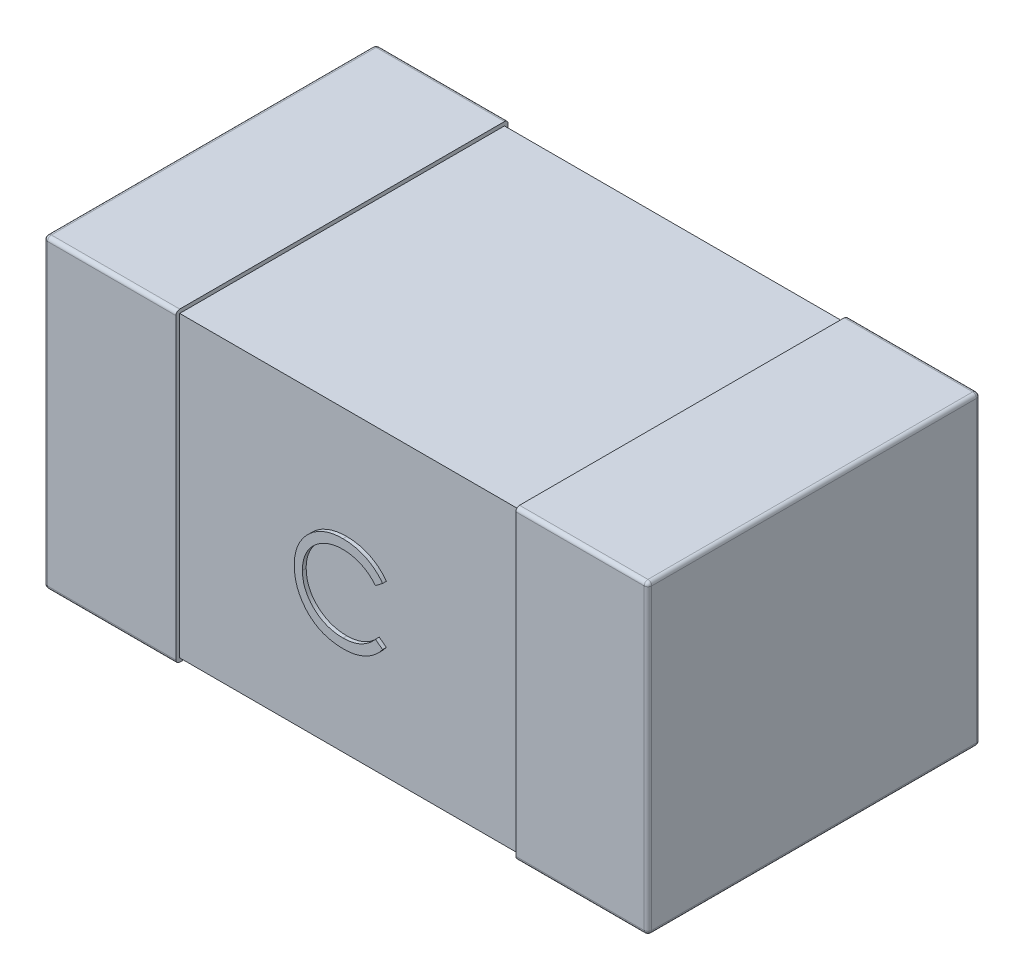
from build123d import *

# Parameters (mm, degrees)
EXTRUDE_1_DEPTH        = 0.87
EXTRUDE_1_DEPTH_BACK   = 0.01
SKETCH_3_W             = 0.35
SKETCH_3_H             = 0.81
EXTRUDE_1_2_DEPTH      = 0.87
EXTRUDE_1_2_DEPTH_BACK = 0.01
SKETCH_5_W             = 0.86
SKETCH_5_H             = 0.79
EXTRUDE_3_DEPTH        = 0.455
FILLET_3_R             = 0.01
EXTRUDE_4_DEPTH        = 0.01


with BuildPart() as part:
    # 草图3 → 凸台-拉伸1 (new, two sides: drawn at the far end of the back side and taken through both)
    with BuildSketch(Plane.XY.offset(-EXTRUDE_1_DEPTH_BACK)):
        with Locations((-0.625, 0)):
            Rectangle(SKETCH_3_W, SKETCH_3_H)
    extrude(amount=EXTRUDE_1_DEPTH + EXTRUDE_1_DEPTH_BACK)



with BuildPart() as body_2:
    # 草图3 → Extrude 1 2 (new, two sides: drawn at the far end of the back side and taken through both)
    with BuildSketch(Plane.XY.offset(-EXTRUDE_1_2_DEPTH_BACK)):
        with Locations((0.625, 0)):
            Rectangle(SKETCH_3_W, SKETCH_3_H)
    extrude(amount=EXTRUDE_1_2_DEPTH + EXTRUDE_1_2_DEPTH_BACK)


with BuildPart() as part_1:
    add(part.part)

    add(body_2.part)  # 凸台-拉伸3 merges body 2
    # 草图5 → 凸台-拉伸3 (add, symmetric)
    with BuildSketch(Plane(origin=(0, 0, 0), x_dir=(0, 0, -1), z_dir=(1, 0, 0))):
        with Locations((-0.43, 0)):
            Rectangle(SKETCH_5_W, SKETCH_5_H)
    extrude(amount=EXTRUDE_3_DEPTH, both=True)

    # 圆角3
    fillet_3_edges = [part_1.edges().sort_by_distance(p)[0] for p in [
        (-0.8, 0, -0.01),
        (-0.625, 0.405, 0.87),
        (-0.625, -0.405, -0.01),
        (-0.8, 0, 0.87),
        (-0.625, -0.405, 0.87),
        (0.8, 0.405, 0.43),
        (0.8, 0, -0.01),
        (0.8, -0.405, 0.43),
        (0.625, -0.405, -0.01),
        (0.625, 0.405, -0.01),
        (0.8, 0, 0.87),
        (0.625, 0.405, 0.87),
        (0.625, -0.405, 0.87),
        (-0.625, 0.405, -0.01),
        (-0.8, -0.405, 0.43),
        (-0.8, 0.405, 0.43),
    ]]
    fillet(fillet_3_edges, radius=FILLET_3_R)

    # 草图6 → 凸台-拉伸4 (add)
    with BuildSketch(Plane.XY.offset(0.86)):
        with BuildLine():
            Line((0.097254857, 0.0543379), (0.078408703, 0.039914823))
            add(Edge.make_bspline(
                [(0.078408703, 0.039914823), (0.077064299, 0.041517061), (0.074393617, 0.044699935), (0.070096986, 0.04916939), (0.065619159, 0.053356722), (0.060961848, 0.057281879), (0.056041223, 0.0608076), (0.050976482, 0.064117619), (0.045682902, 0.067084549), (0.038362783, 0.070682011), (0.02878693, 0.074436033), (0.016732427, 0.077583684), (0.004148809, 0.079587421), (-0.004436169, 0.079804439), (-0.008802836, 0.079914823)],
                knots=[0, 0, 0, 0, 0.757959112, 1.505699292, 2.245454638, 2.979532153, 3.711538275, 4.438200793, 5.171680507, 5.909471876, 7.393775596, 8.890124382, 10.418191784, 12, 12, 12, 12], degree=3))
            add(Edge.make_bspline(
                [(-0.008802836, 0.079914823), (-0.011208548, 0.079887123), (-0.015997644, 0.079831979), (-0.023104968, 0.079104496), (-0.030079577, 0.078082013), (-0.036916935, 0.076564848), (-0.043608338, 0.074646726), (-0.050197531, 0.072354697), (-0.056589115, 0.069518937), (-0.062871509, 0.066384656), (-0.068890654, 0.062844489), (-0.074585858, 0.058983002), (-0.079936347, 0.054843407), (-0.084946355, 0.050410188), (-0.089621003, 0.045703311), (-0.093926418, 0.040672613), (-0.097847703, 0.035334178), (-0.101462585, 0.029758402), (-0.10470003, 0.023961524), (-0.10741065, 0.017922091), (-0.109811001, 0.011743524), (-0.111710378, 0.005356016), (-0.113213773, -0.001195488), (-0.114251099, -0.007928571), (-0.114970308, -0.014829166), (-0.115025178, -0.019506376), (-0.115052836, -0.021864023)],
                knots=[0, 0, 0, 0, 1.054917814, 2.100044995, 3.131103042, 4.146048494, 5.169673617, 6.183595914, 7.203665975, 8.234915748, 9.262203917, 10.264457458, 11.251630812, 12.227803204, 13.197192746, 14.159520551, 15.12972552, 16.100847026, 17.073214652, 18.039054194, 19.002613845, 19.979014051, 20.95965708, 21.949030935, 22.966165397, 24, 24, 24, 24], degree=3))
            add(Edge.make_bspline(
                [(-0.115052836, -0.021864023), (-0.114966311, -0.025411314), (-0.114796431, -0.032375948), (-0.113284545, -0.042577361), (-0.110987053, -0.052350208), (-0.107543699, -0.061633397), (-0.103297822, -0.070541398), (-0.097932751, -0.078923491), (-0.091719046, -0.086906341), (-0.0845688, -0.094301286), (-0.07672383, -0.101056513), (-0.06830683, -0.107005125), (-0.059338764, -0.111963859), (-0.049918653, -0.11609021), (-0.039974005, -0.1192621), (-0.029522704, -0.121495068), (-0.018587482, -0.122951675), (-0.011115294, -0.123091128), (-0.007312451, -0.1231621)],
                knots=[0, 0, 0, 0, 1.029171465, 2.020641659, 2.987623507, 3.938342917, 4.889210282, 5.84687017, 6.821220943, 7.821438502, 8.827599549, 9.822697543, 10.807740252, 11.797342354, 12.80366471, 13.83203677, 14.896651826, 16, 16, 16, 16], degree=3))
            add(Edge.make_bspline(
                [(-0.007312451, -0.1231621), (-0.003122552, -0.123046298), (0.005124171, -0.122818372), (0.017217978, -0.120887452), (0.028795288, -0.117756623), (0.039856722, -0.113375052), (0.050371098, -0.107679146), (0.060354869, -0.100774149), (0.069816462, -0.092594377), (0.075505922, -0.086348677), (0.078408703, -0.0831621)],
                knots=[0, 0, 0, 0, 1.028121516, 2.023589091, 2.998037872, 3.967518031, 4.937445131, 5.927275754, 6.942489185, 8, 8, 8, 8], degree=3))
            Line((0.078408703, -0.0831621), (0.097254857, -0.097440946))
            add(Edge.make_bspline(
                [(0.097254857, -0.097440946), (0.095738186, -0.099397869), (0.09271211, -0.10330234), (0.087812132, -0.108806686), (0.08265026, -0.113984105), (0.077188154, -0.118792857), (0.071488649, -0.123329163), (0.065449404, -0.127464145), (0.059149814, -0.13125552), (0.052611221, -0.134727081), (0.045840573, -0.137807121), (0.038845983, -0.140443951), (0.031657601, -0.142715372), (0.024275097, -0.144584076), (0.01668316, -0.146042664), (0.008909184, -0.147017728), (0.000936393, -0.147685745), (-0.004442447, -0.14774663), (-0.00716822, -0.147777485)],
                knots=[0, 0, 0, 0, 0.986787822, 1.968848986, 2.935600012, 3.899624008, 4.868462664, 5.837806735, 6.815139263, 7.798259679, 8.787526145, 9.778297419, 10.776456485, 11.791383307, 12.812564526, 13.85620153, 14.913611965, 16, 16, 16, 16], degree=3))
            add(Edge.make_bspline(
                [(-0.00716822, -0.147777485), (-0.0097495, -0.14775952), (-0.014853662, -0.147723996), (-0.022389576, -0.147148533), (-0.029726005, -0.146363408), (-0.036841979, -0.145181227), (-0.043776332, -0.143786187), (-0.0504662, -0.141916158), (-0.056977415, -0.139821358), (-0.063283815, -0.137359302), (-0.069390766, -0.134581049), (-0.07527857, -0.131441057), (-0.08094452, -0.127965729), (-0.08644432, -0.124231671), (-0.091696726, -0.120118942), (-0.096747253, -0.115684658), (-0.101624223, -0.110943766), (-0.10464155, -0.107525147), (-0.106158605, -0.105806331)],
                knots=[0, 0, 0, 0, 1.114604814, 2.203992996, 3.262667896, 4.300477797, 5.318619304, 6.316056647, 7.298880507, 8.271930387, 9.238335007, 10.195173496, 11.151986948, 12.108099108, 13.064862484, 14.031167946, 15.010108607, 16, 16, 16, 16], degree=3))
            add(Edge.make_bspline(
                [(-0.106158605, -0.105806331), (-0.108588477, -0.102820649), (-0.113418887, -0.096885332), (-0.119598934, -0.087265722), (-0.124889052, -0.077222188), (-0.129166258, -0.066701964), (-0.132509989, -0.055728657), (-0.134826413, -0.044296736), (-0.136331666, -0.032416877), (-0.1365038, -0.024336641), (-0.136591297, -0.020229408)],
                knots=[0, 0, 0, 0, 0.994628077, 1.977248131, 2.950237994, 3.925870899, 4.908910175, 5.911660606, 6.938484602, 8, 8, 8, 8], degree=3))
            add(Edge.make_bspline(
                [(-0.136591297, -0.020229408), (-0.136484655, -0.015912462), (-0.136274844, -0.007419142), (-0.134492275, 0.005045358), (-0.131624701, 0.016987168), (-0.127551771, 0.028383996), (-0.122387976, 0.039295787), (-0.116009008, 0.049639184), (-0.108488975, 0.059480336), (-0.099886856, 0.068669919), (-0.090453668, 0.077072617), (-0.080351806, 0.084465043), (-0.069601044, 0.090617101), (-0.05831982, 0.095759695), (-0.046423659, 0.099712458), (-0.033937942, 0.102479534), (-0.020886131, 0.10420185), (-0.011981279, 0.104419579), (-0.007456682, 0.104530208)],
                knots=[0, 0, 0, 0, 1.032925535, 2.032216505, 3.007276963, 3.968222605, 4.92396291, 5.891752235, 6.871517503, 7.883894988, 8.900124299, 9.891468569, 10.874487609, 11.85992873, 12.854644235, 13.869047385, 14.917252991, 16, 16, 16, 16], degree=3))
            add(Edge.make_bspline(
                [(-0.007456682, 0.104530208), (-0.004699118, 0.104497147), (0.000759202, 0.104431706), (0.008833669, 0.10379357), (0.016694858, 0.10272978), (0.024348182, 0.101281821), (0.031830876, 0.099484748), (0.039085749, 0.097143699), (0.046155374, 0.094466908), (0.052995162, 0.091384042), (0.059572297, 0.087923465), (0.06588473, 0.084123537), (0.07188232, 0.079988967), (0.07760727, 0.075554921), (0.08296381, 0.070727591), (0.088104026, 0.065639756), (0.092853357, 0.060144865), (0.095785004, 0.056277098), (0.097254857, 0.0543379)],
                knots=[0, 0, 0, 0, 1.096760587, 2.17092713, 3.219439832, 4.250915756, 5.268269357, 6.278326846, 7.281116186, 8.274029601, 9.260640565, 10.235837813, 11.203064059, 12.156899882, 13.114053108, 14.069676657, 15.032185724, 16, 16, 16, 16], degree=3))
        make_face()
    extrude(amount=EXTRUDE_4_DEPTH)


solid = part_1.part
